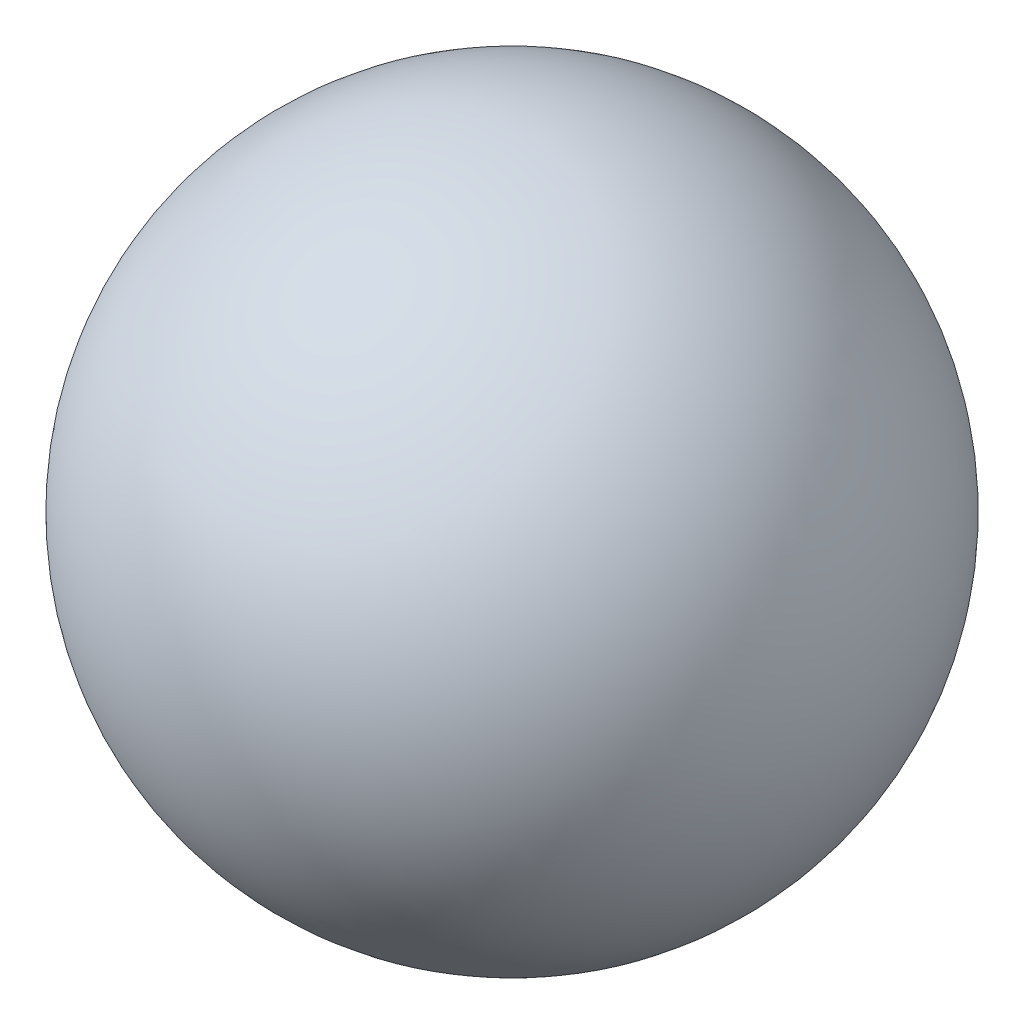
from build123d import *


with BuildPart() as part:
    # Sketch1 → Revolve1 (revolve)
    with BuildSketch(Plane.XY):
        with BuildLine():
            Line((0, 1000), (0, 800))
            ThreePointArc((0, 800), (800, 0), (0, -800))
            Line((0, -800), (0, -1000))
            ThreePointArc((0, -1000), (1000, 0), (0, 1000))
        make_face()
    revolve(axis=Axis((0, 105.545404412, 0), (0, -1, 0)))


solid = part.part
